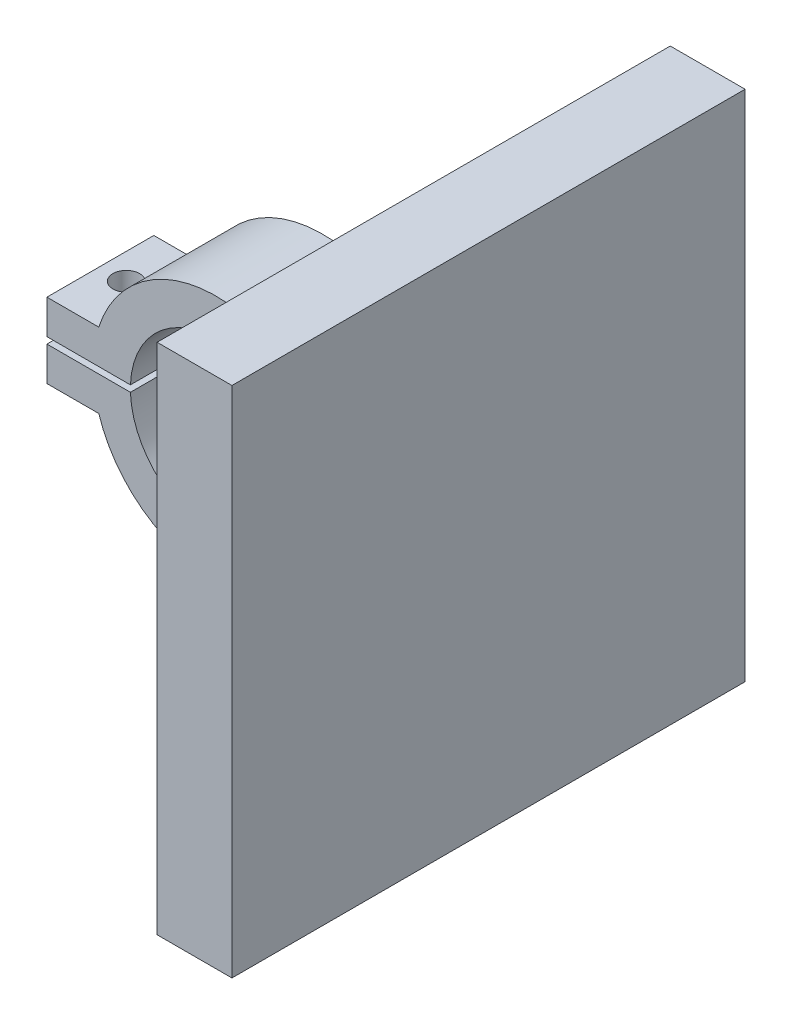
from build123d import *

# Parameters (mm, degrees)
SALIENTE_EXTRUIR3_DEPTH    = 5
CORTAR_EXTRUIR2_DEPTH      = 11.978246956
CORTAR_EXTRUIR2_DEPTH_BACK = 11.978246956
CROQUIS5_R                 = 0.625
CROQUIS7_W                 = 24
CROQUIS7_H                 = 24
SALIENTE_EXTRUIR5_DEPTH    = 3.5


with BuildPart() as part:
    # Croquis1 → Saliente-Extruir3 (new body)
    with BuildSketch(Plane.XY):
        with BuildLine():
            ThreePointArc((5.390964663, 2), (-0.132231752, 5.748479344), (-5.477225575, 1.75))
            Line((-5.477225575, 1.75), (-3.596873642, 1.75))
            ThreePointArc((-3.596873642, 1.75), (0.897915762, 3.897915762), (4, 0))
            ThreePointArc((4, 0), (0.897915762, -3.897915762), (-3.596873642, -1.75))
            Line((-3.596873642, -1.75), (-5.477225575, -1.75))
            ThreePointArc((-5.477225575, -1.75), (-0.132231752, -5.748479344), (5.390964663, -2))
            Line((5.390964663, -2), (4.749257399, -2))
            Line((4.749257399, -2), (4.749257399, 2))
            Line((4.749257399, 2), (5.390964663, 2))
        make_face()
        with BuildLine():
            Line((-5.748043145, -0.15), (-7.903126358, -0.15))
            Line((-7.903126358, -0.15), (-7.903126358, -1.75))
            Line((-7.903126358, -1.75), (-5.477225575, -1.75))
            ThreePointArc((-5.477225575, -1.75), (-5.66936191, -0.959601761), (-5.748043145, -0.15))
        make_face()
        with BuildLine():
            Line((-5.477225575, 1.75), (-7.903126358, 1.75))
            Line((-7.903126358, 1.75), (-7.903126358, 0.15))
            Line((-7.903126358, 0.15), (-5.748043145, 0.15))
            ThreePointArc((-5.748043145, 0.15), (-5.66936191, 0.959601761), (-5.477225575, 1.75))
        make_face()
        with BuildLine():
            Line((-3.596873642, 1.75), (-5.477225575, 1.75))
            ThreePointArc((-5.477225575, 1.75), (-5.66936191, 0.959601761), (-5.748043145, 0.15))
            Line((-5.748043145, 0.15), (-3.997186511, 0.15))
            ThreePointArc((-3.997186511, 0.15), (-3.880391398, 0.970856631), (-3.596873642, 1.75))
        make_face()
        with BuildLine():
            Line((-3.997186511, -0.15), (-5.748043145, -0.15))
            ThreePointArc((-5.748043145, -0.15), (-5.66936191, -0.959601761), (-5.477225575, -1.75))
            Line((-5.477225575, -1.75), (-3.596873642, -1.75))
            ThreePointArc((-3.596873642, -1.75), (-3.880391398, -0.970856631), (-3.997186511, -0.15))
        make_face()
        with BuildLine():
            Line((6.750742601, 2), (5.390964663, 2))
            ThreePointArc((5.390964663, 2), (5.659529433, 1.015985528), (5.75, 0))
            ThreePointArc((5.75, 0), (5.659529433, -1.015985528), (5.390964663, -2))
            Line((5.390964663, -2), (6.750742601, -2))
            Line((6.750742601, -2), (6.750742601, 2))
        make_face()
        with BuildLine():
            ThreePointArc((5.75, 0), (5.659529433, 1.015985528), (5.390964663, 2))
            Line((5.390964663, 2), (4.749257399, 2))
            Line((4.749257399, 2), (4.749257399, -2))
            Line((4.749257399, -2), (5.390964663, -2))
            ThreePointArc((5.390964663, -2), (5.659529433, -1.015985528), (5.75, 0))
        make_face()
    extrude(amount=SALIENTE_EXTRUIR3_DEPTH)

    # Croquis5 → Cortar-Extruir2 (cut, two sides: drawn at the far end of the back side and taken through both)
    with BuildSketch(Plane(origin=(0, 0, 0), x_dir=(1, 0, 0), z_dir=(0, 1, 0)).offset(-CORTAR_EXTRUIR2_DEPTH_BACK)):
        with Locations(Location((-6.690175966, -2.5, 0), (0, 0, 270))):
            Circle(CROQUIS5_R)
    extrude(amount=CORTAR_EXTRUIR2_DEPTH + CORTAR_EXTRUIR2_DEPTH_BACK, mode=Mode.SUBTRACT)

    # Croquis7 → Saliente-Extruir5 (add)
    with BuildSketch(Plane(origin=(6.750742601, 0, 0), x_dir=(0, 0, -1), z_dir=(1, 0, 0))):
        with Locations((-2.5, 0)):
            Rectangle(CROQUIS7_W, CROQUIS7_H)
    extrude(amount=SALIENTE_EXTRUIR5_DEPTH)


solid = part.part
